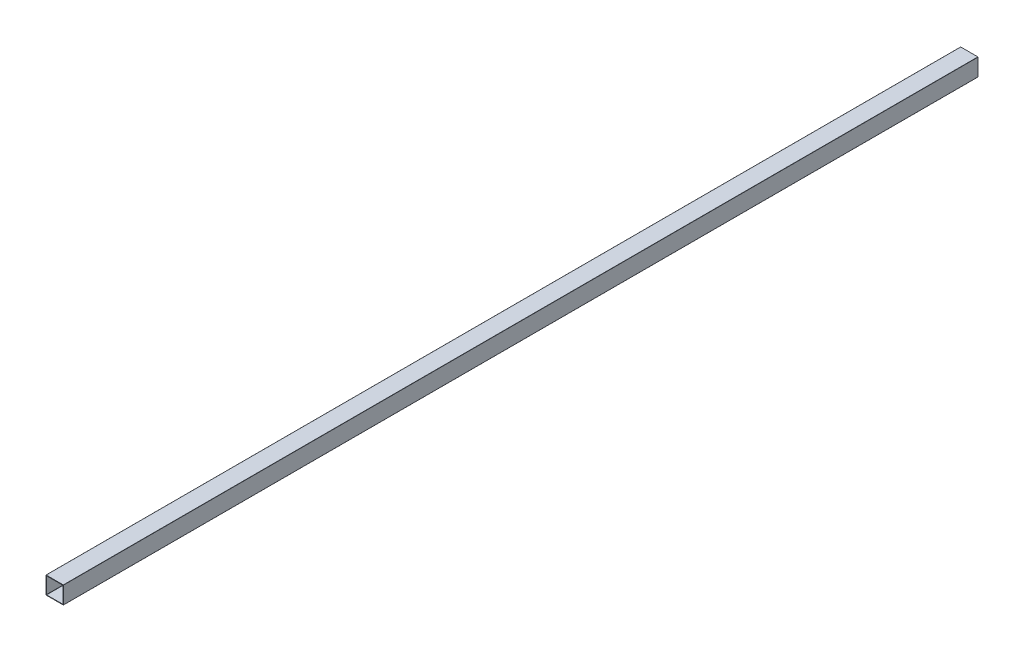
from build123d import *

# Parameters (mm, degrees)
CROQUIS1_W              = 114.3
CROQUIS1_H              = 114.3
CROQUIS1_W_2            = 108.22
CROQUIS1_H_2            = 108.22
SALIENTE_EXTRUIR1_DEPTH = 6000
REDONDEO1_R             = 1


with BuildPart() as part:
    # Croquis1 → Saliente-Extruir1 (new body)
    with BuildSketch(Plane.XY):
        Rectangle(CROQUIS1_W, CROQUIS1_H)
        Rectangle(CROQUIS1_W_2, CROQUIS1_H_2, mode=Mode.SUBTRACT)
    extrude(amount=-SALIENTE_EXTRUIR1_DEPTH)

    # Redondeo1
    redondeo1_edges = [part.edges().sort_by_distance(p)[0] for p in [
        (54.11, -54.11, -3000),
        (-54.11, -54.11, -3000),
        (-54.11, 54.11, -3000),
        (54.11, 54.11, -3000),
        (57.15, -57.15, -3000),
        (-57.15, -57.15, -3000),
        (-57.15, 57.15, -3000),
        (57.15, 57.15, -3000),
    ]]
    fillet(redondeo1_edges, radius=REDONDEO1_R)


solid = part.part
